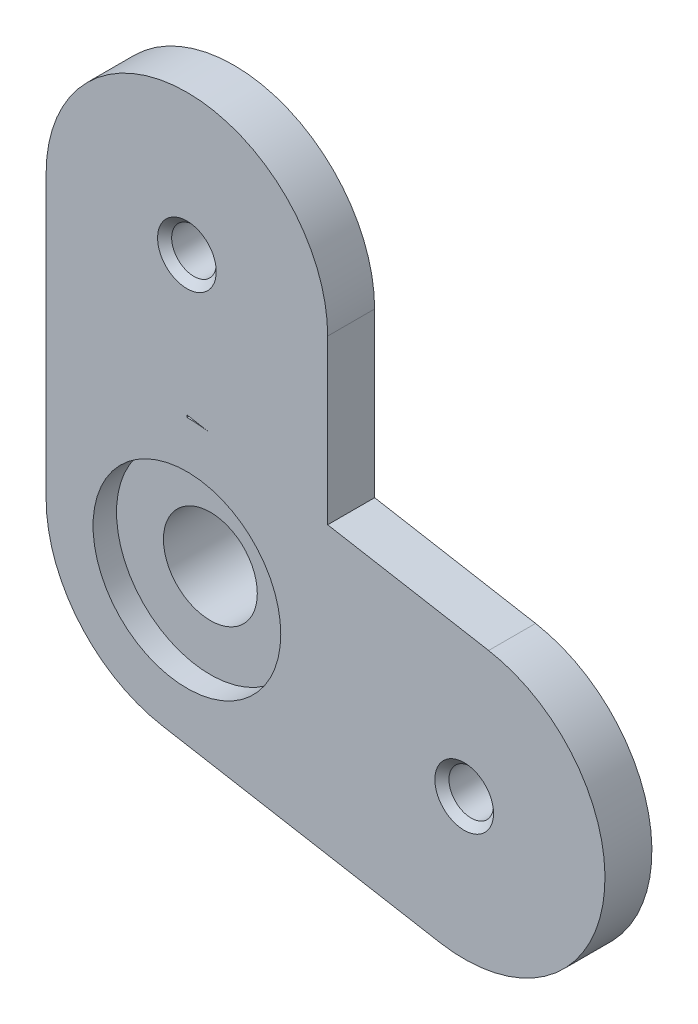
from build123d import *

# Parameters (mm, degrees)
EXTRUDE_1_DEPTH          = 1
SKETCH_2_R               = 2.5
EXTRUDE_2_DEPTH          = 3
SKETCH_3_R               = 1
CUT_EXTRUDE_1_DEPTH      = 14.280344359
SKETCH_4_R               = 2
CUT_EXTRUDE_2_DEPTH      = 0.5
CUT_EXTRUDE_3_DEPTH      = 14.014128718
CUT_EXTRUDE_3_DEPTH_BACK = 14.014128718
M1_2X0_25_1_D            = 0.95
M1_2X0_25_1_CSINK_D      = 1.25
M1_2X0_25_1_CSINK_ANGLE  = 90


with BuildPart() as part:
    # 草图1 → 凸台-拉伸1 (new body)
    with BuildSketch(Plane.XY):
        with BuildLine():
            ThreePointArc((5.387901985, -3.996312325), (8.863269777, -1.562833599), (6.429791051, 1.912534193))
            Line((6.429791051, 1.912534193), (3, 2.517298894))
            Line((3, 2.517298894), (3, 6))
            ThreePointArc((3, 6), (0, 9), (-3, 6))
            Line((-3, 6), (-3, 0))
            ThreePointArc((-3, 0), (-2.298133329, -1.928362829), (-0.520944533, -2.954423259))
            Line((-0.520944533, -2.954423259), (5.387901985, -3.996312325))
        make_face()
        with BuildLine():
            ThreePointArc((0.520944516, 2.954423262), (0.26146722, 2.988584095), (1e-09, 3))
            Line((0, 3), (0, 3.046279836))
            Line((0, 3.046279836), (0.520944516, 2.954423262))
        make_face(mode=Mode.SUBTRACT)
    extrude(amount=EXTRUDE_1_DEPTH)

    # 草图2 → 凸台-拉伸2 (add)
    with BuildSketch(Plane(origin=(0, 0, 0), x_dir=(-1, 0, 0), z_dir=(0, 0, -1))):
        with Locations(Location((0, 0, 0), (0, 0, 180))):
            Circle(SKETCH_2_R)
    extrude(amount=EXTRUDE_2_DEPTH)

    # 草图3 → 切除-拉伸1 (cut, through all)
    with BuildSketch(Plane(origin=(0, 0, -3), x_dir=(-1, 0, 0), z_dir=(0, 0, -1))):
        Circle(SKETCH_3_R)
    extrude(amount=-CUT_EXTRUDE_1_DEPTH, mode=Mode.SUBTRACT)

    # 草图4 → 切除-拉伸2 (cut)
    with BuildSketch(Plane.XY.offset(1)):
        Circle(SKETCH_4_R)
    extrude(amount=-CUT_EXTRUDE_2_DEPTH, mode=Mode.SUBTRACT)

    # 草图5 → 切除-拉伸3 (cut, two sides: drawn at the far end of the back side and taken through both)
    with BuildSketch(Plane(origin=(0, 0, 0), x_dir=(1, 0, 0), z_dir=(0, 1, 0)).offset(-CUT_EXTRUDE_3_DEPTH_BACK)):
        Polygon((-2.5, 3), (2.5, 0.113248654), (2.5, 3), align=None)
    extrude(amount=CUT_EXTRUDE_3_DEPTH + CUT_EXTRUDE_3_DEPTH_BACK, mode=Mode.SUBTRACT)

    # M1.2x0.25 螺纹孔1 (through all)
    with Locations(Plane.XY.offset(1)):
        with Locations((0, 6), (5.908846518, -1.041889066)):
            CounterSinkHole(M1_2X0_25_1_D / 2, M1_2X0_25_1_CSINK_D / 2, counter_sink_angle=M1_2X0_25_1_CSINK_ANGLE)


solid = part.part
